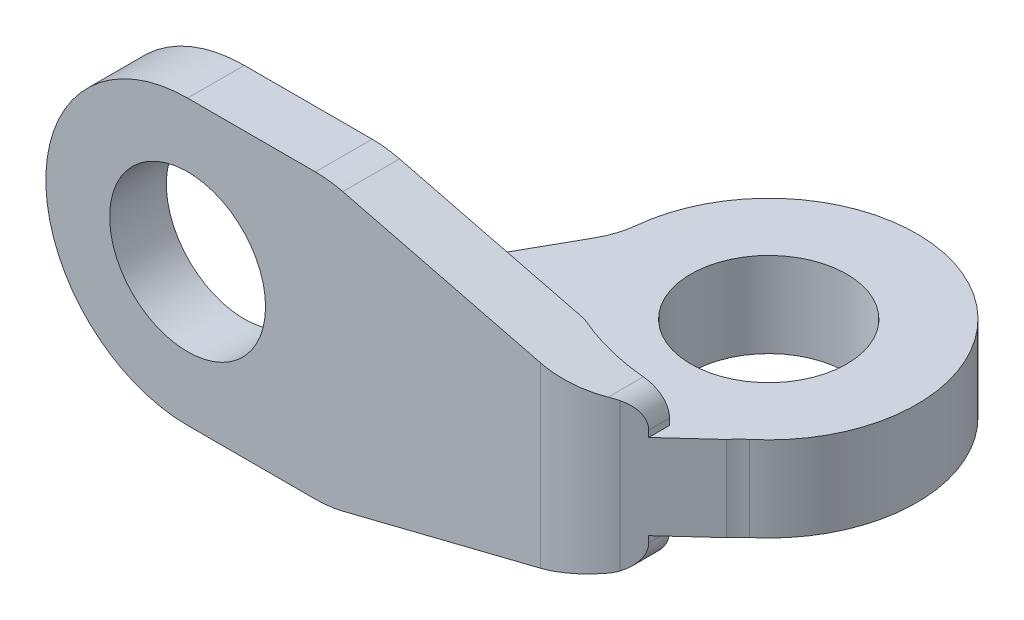
from build123d import *

# Parameters (mm, degrees)
SKETCH1_R                = 2.75
BOSS_EXTRUDE1_DEPTH      = 2
BOSS_EXTRUDE2_DEPTH      = 2.5
BOSS_EXTRUDE2_DEPTH_BACK = 0.5
FILLET1_R                = 3
CUT_EXTRUDE1_DEPTH       = 4.9
CUT_EXTRUDE1_DEPTH_BACK  = 3.5
FILLET2_R                = 3
SKETCH5_R                = 5.220153254
CUT_EXTRUDE2_DEPTH       = 3.5
SKETCH6_R                = 5.221148533
CUT_EXTRUDE3_DEPTH       = 3.5


with BuildPart() as part:
    # Sketch1 → Boss-Extrude1 (new body)
    with BuildSketch(Plane.XY):
        with BuildLine():
            Line((9.508808554, 0), (5, 0))
            ThreePointArc((5, 0), (1.464466094, -1.464466094), (0, -5))
            ThreePointArc((0, -5), (1.464466094, -8.535533906), (5, -10))
            Line((5, -10), (9.508808554, -10))
            ThreePointArc((9.508808554, -10), (9.996319776, -9.970105151), (10.476525698, -9.880868576))
            Line((10.476525698, -9.880868576), (19.242535625, -7.689366094))
            ThreePointArc((19.242535625, -7.689366094), (19.788205438, -7.334635803), (20, -6.719223594))
            Line((20, -6.719223594), (20, -4.609611797))
            Line((20, -4.609611797), (20, -3.280776406))
            ThreePointArc((20, -3.280776406), (19.788205438, -2.665364197), (19.242535625, -2.310633906))
            Line((19.242535625, -2.310633906), (10.476525698, -0.119131424))
            ThreePointArc((10.476525698, -0.119131424), (9.996319776, -0.029894849), (9.508808554, 0))
        make_face()
        with Locations((5, -5)):
            Circle(SKETCH1_R, mode=Mode.SUBTRACT)
    extrude(amount=BOSS_EXTRUDE1_DEPTH)

    # Sketch3 → Boss-Extrude2 (add, two sides: drawn at the far end of the back side and taken through both)
    with BuildSketch(Plane(origin=(0, -4, 0), x_dir=(-1, 0, 0), z_dir=(0, -1, 0)).offset(-BOSS_EXTRUDE2_DEPTH_BACK)):
        with BuildLine():
            ThreePointArc((-23.720153254, 5), (-23.109616483, 2.550217177), (-21.420820041, 0.673475957))
            Line((-21.420820041, 0.673475957), (-23.720153254, 5))
        make_face()
        with BuildLine():
            ThreePointArc((-21.420820041, 0.673475957), (-20.735912548, 0.282935757), (-20, 0))
            Line((-20, 0), (-20, 2.695113886))
            ThreePointArc((-20, 2.695113886), (-19.81101106, 7.417384951), (-15.75, 5))
            ThreePointArc((-15.75, 5), (-15.856067672, 4.243612637), (-16.166088613, 3.54557309))
            Line((-16.166088613, 3.54557309), (-14.069681773, 2.23915223))
            ThreePointArc((-14.069681773, 2.23915223), (-13.481188382, 3.564197108), (-13.279846746, 5))
            ThreePointArc((-13.279846746, 5), (-18.5, 10.220153254), (-23.720153254, 5))
            Line((-23.720153254, 5), (-21.420820041, 0.673475957))
        make_face()
        with BuildLine():
            Line((-20, 2.695113886), (-20, 0))
            ThreePointArc((-20, 0), (-16.65605263, 0.11636835), (-14.069681773, 2.23915223))
            Line((-14.069681773, 2.23915223), (-16.166088613, 3.54557309))
            ThreePointArc((-16.166088613, 3.54557309), (-17.904456328, 2.315260211), (-20, 2.695113886))
        make_face()
        with BuildLine():
            ThreePointArc((-13.279846746, 5), (-13.481188382, 3.564197108), (-14.069681773, 2.23915223))
            Line((-14.069681773, 2.23915223), (-10.476525698, 0))
            Line((-10.476525698, 0), (-13.279846746, 5))
        make_face()
        with BuildLine():
            ThreePointArc((-14.069681773, 2.23915223), (-16.65605263, 0.11636835), (-20, 0))
            ThreePointArc((-20, 0), (-20.735912548, 0.282935757), (-21.420820041, 0.673475957))
            Line((-21.420820041, 0.673475957), (-20, -2))
            Line((-20, -2), (-10.476525698, 0))
            Line((-10.476525698, 0), (-14.069681773, 2.23915223))
        make_face()
    extrude(amount=BOSS_EXTRUDE2_DEPTH + BOSS_EXTRUDE2_DEPTH_BACK)

    # Fillet1
    fillet1_edges = [part.edges().sort_by_distance(p)[0] for p in [
        (10.476525698, -5, 0),
        (21.420820041, -5, -0.673475957),
        (13.279846746, -5, -5),
    ]]
    fillet(fillet1_edges, radius=FILLET1_R)

    # Sketch4 → Cut-Extrude1 (cut, two sides: drawn at the far end of the back side and taken through both)
    with BuildSketch(Plane(origin=(0, -4, 0), x_dir=(-1, 0, 0), z_dir=(0, -1, 0)).offset(-CUT_EXTRUDE1_DEPTH_BACK)):
        Polygon((-21.432511864, 0.575653333), (-18.613235122, -2), (-20, -2), align=None)
    extrude(amount=CUT_EXTRUDE1_DEPTH + CUT_EXTRUDE1_DEPTH_BACK, mode=Mode.SUBTRACT)

    # Fillet2
    fillet2_edges = [part.edges().sort_by_distance(p)[0] for p in [
        (18.613235122, -5, 2),
    ]]
    fillet(fillet2_edges, radius=FILLET2_R)

    # Sketch5 → Cut-Extrude2 (cut)
    with BuildSketch(Plane.XZ.offset(6.5)):
        with Locations((18.5, -5)):
            Circle(SKETCH5_R)
    extrude(amount=CUT_EXTRUDE2_DEPTH, mode=Mode.SUBTRACT)

    # Sketch6 → Cut-Extrude3 (cut)
    with BuildSketch(Plane(origin=(0, -3.5, 0), x_dir=(1, 0, 0), z_dir=(0, 1, 0))):
        with Locations((18.5, 5)):
            Circle(SKETCH6_R)
    extrude(amount=CUT_EXTRUDE3_DEPTH, mode=Mode.SUBTRACT)


solid = part.part
